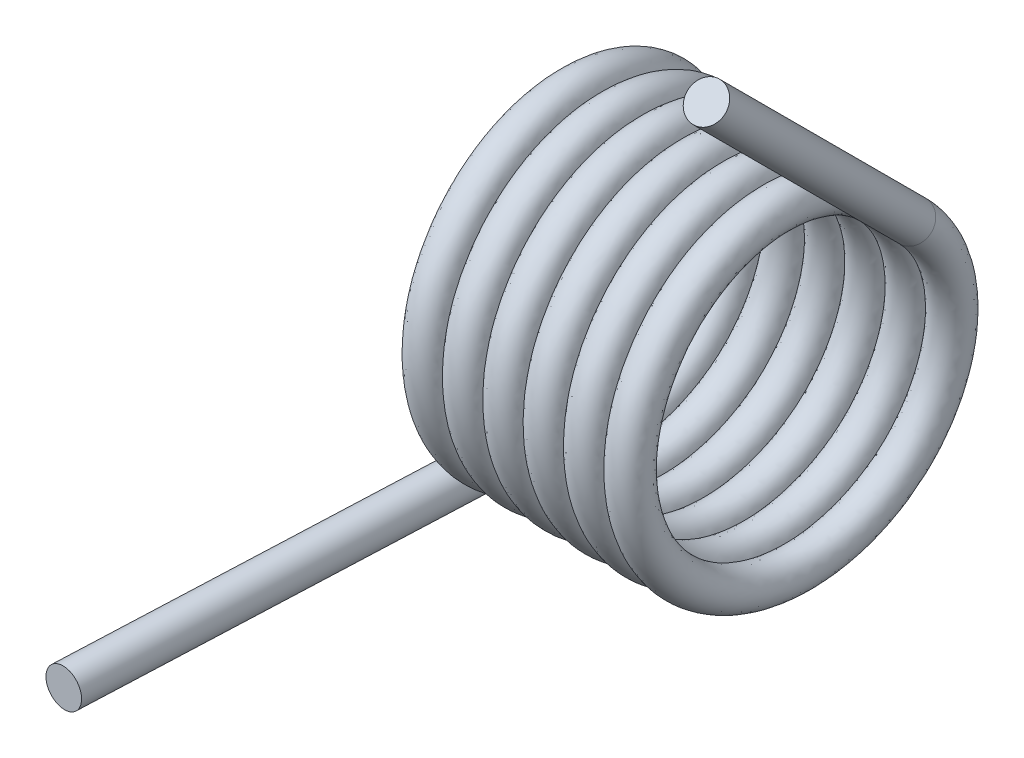
from build123d import *

# Parameters (mm, degrees)
SWEEP1_PITCH       = 0.3302
SWEEP1_HEIGHT      = 2.105025
SWEEP1_RADIUS      = 1.2319
SWEEP1_START_ANGLE = 90
SKETCH2_R          = 0.1524
SKETCH3_R          = 0.1524
EXTRUDE1_DEPTH     = 3.81
SKETCH4_R          = 0.1524
EXTRUDE2_DEPTH     = 2.54


with BuildPart() as part:
    # Sweep1: sweep along a helix
    with BuildLine() as sweep1_path:
        add(Helix(SWEEP1_PITCH, SWEEP1_HEIGHT, SWEEP1_RADIUS, center=(0, 0, 0), direction=(1, 0, 0), mode=Mode.PRIVATE).rotate(Axis((0, 0, 0), (1, 0, 0)), SWEEP1_START_ANGLE))
    # Sketch2 → Sweep1 (sweep)
    with BuildSketch(Plane(origin=(0, -1.2319, 0), x_dir=(-0.9990912985626407, 2.684849729745596e-14, -0.042621322555927425), z_dir=(0.042621322555927425, 1.0817088978066002e-14, -0.9990912985626407))):
        Circle(SKETCH2_R)
    sweep(path=sweep1_path.line, is_frenet=True)

    # Sketch3 → Extrude1 (add)
    with BuildSketch(Plane(origin=(0, 0, 0), x_dir=(0.9990912985626407, -2.682074438491412e-14, 0.04262132255592743), z_dir=(-0.04262132255592743, -1.0817088978066004e-14, 0.9990912985626407))):
        with Locations((0, -1.2319)):
            Circle(SKETCH3_R)
    extrude(amount=EXTRUDE1_DEPTH)

    # Sketch4 → Extrude2 (add)
    with BuildSketch(Plane(origin=(0.00382394, 0.063383229, 0.063383229), x_dir=(-0.9779256913157212, 0.17427663390157874, -0.11527791263118937), z_dir=(0.042621322555927404, 0.7064642322380456, 0.706464232238188))):
        with Locations(Location((-1.806331451, -1.636406141, 0), (0, 0, 11.814629565))):
            Circle(SKETCH4_R)
    extrude(amount=EXTRUDE2_DEPTH)


solid = part.part
